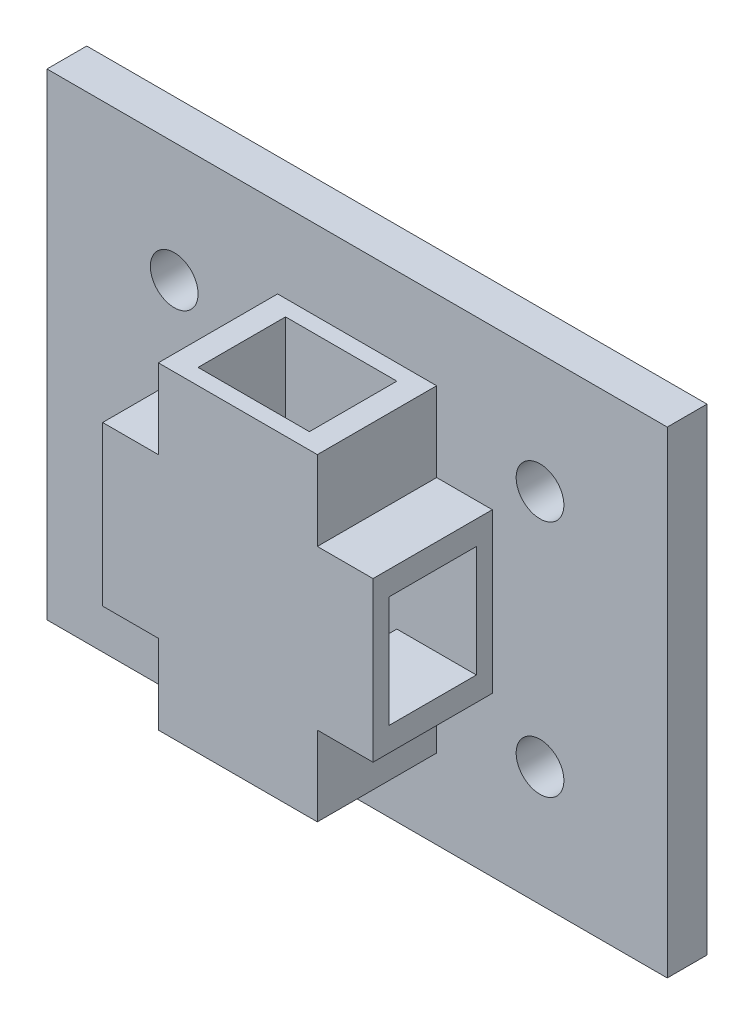
from build123d import *

# Parameters (mm, degrees)
SKETCH1_W           = 78
SKETCH1_H           = 60
BOSS_EXTRUDE1_DEPTH = 5
SKETCH2_W           = 34
SKETCH2_H           = 40
BOSS_EXTRUDE2_DEPTH = 15
SKETCH4_W           = 7
SKETCH4_H           = 10
CUT_EXTRUDE1_DEPTH  = 15
SKETCH5_W           = 14
SKETCH5_H           = 11
CUT_EXTRUDE2_DEPTH  = 67.615484892
SKETCH6_W           = 11
SKETCH6_H           = 14
CUT_EXTRUDE3_DEPTH  = 72.170921878
SKETCH7_R           = 3
CUT_EXTRUDE4_DEPTH  = 58.375281685


with BuildPart() as part:
    # Sketch1 → Boss-Extrude1 (new body)
    with BuildSketch(Plane.XY):
        with Locations((-0.21253406, 9.10626703)):
            Rectangle(SKETCH1_W, SKETCH1_H)
    extrude(amount=BOSS_EXTRUDE1_DEPTH)

    # Sketch2 → Boss-Extrude2 (add)
    with BuildSketch(Plane.XY.offset(5)):
        with Locations((-0.21253406, 9.10626703)):
            Rectangle(SKETCH2_W, SKETCH2_H)
    extrude(amount=BOSS_EXTRUDE2_DEPTH)

    # Sketch4 → Cut-Extrude1 (cut)
    with BuildSketch(Plane.XY.offset(20)):
        with Locations((-13.71253406, 24.10626703)):
            Rectangle(SKETCH4_W, SKETCH4_H)
        with Locations((13.28746594, 24.10626703)):
            Rectangle(SKETCH4_W, SKETCH4_H)
        with Locations((13.28746594, -5.89373297)):
            Rectangle(SKETCH4_W, SKETCH4_H)
        with Locations((-13.71253406, -5.89373297)):
            Rectangle(SKETCH4_W, SKETCH4_H)
    extrude(amount=-CUT_EXTRUDE1_DEPTH, mode=Mode.SUBTRACT)

    # Sketch5 → Cut-Extrude2 (cut, through all)
    with BuildSketch(Plane.XZ.offset(10.89373297)):
        with Locations((-0.21253406, 12.5)):
            Rectangle(SKETCH5_W, SKETCH5_H)
    extrude(amount=-CUT_EXTRUDE2_DEPTH, mode=Mode.SUBTRACT)

    # Sketch6 → Cut-Extrude3 (cut, through all)
    with BuildSketch(Plane(origin=(16.78746594, 0, 0), x_dir=(0, 0, -1), z_dir=(1, 0, 0))):
        with Locations((-12.5, 9.10626703)):
            Rectangle(SKETCH6_W, SKETCH6_H)
    extrude(amount=-CUT_EXTRUDE3_DEPTH, mode=Mode.SUBTRACT)

    # Sketch7 → Cut-Extrude4 (cut, through all)
    with BuildSketch(Plane.XY.offset(5)):
        with Locations((-23.21253406, 24.10626703)):
            Circle(SKETCH7_R)
        with Locations((22.78746594, 24.10626703)):
            Circle(SKETCH7_R)
        with Locations((22.78746594, -5.89373297)):
            Circle(SKETCH7_R)
        with Locations((-23.21253406, -5.89373297)):
            Circle(SKETCH7_R)
    extrude(amount=-CUT_EXTRUDE4_DEPTH, mode=Mode.SUBTRACT)


solid = part.part
